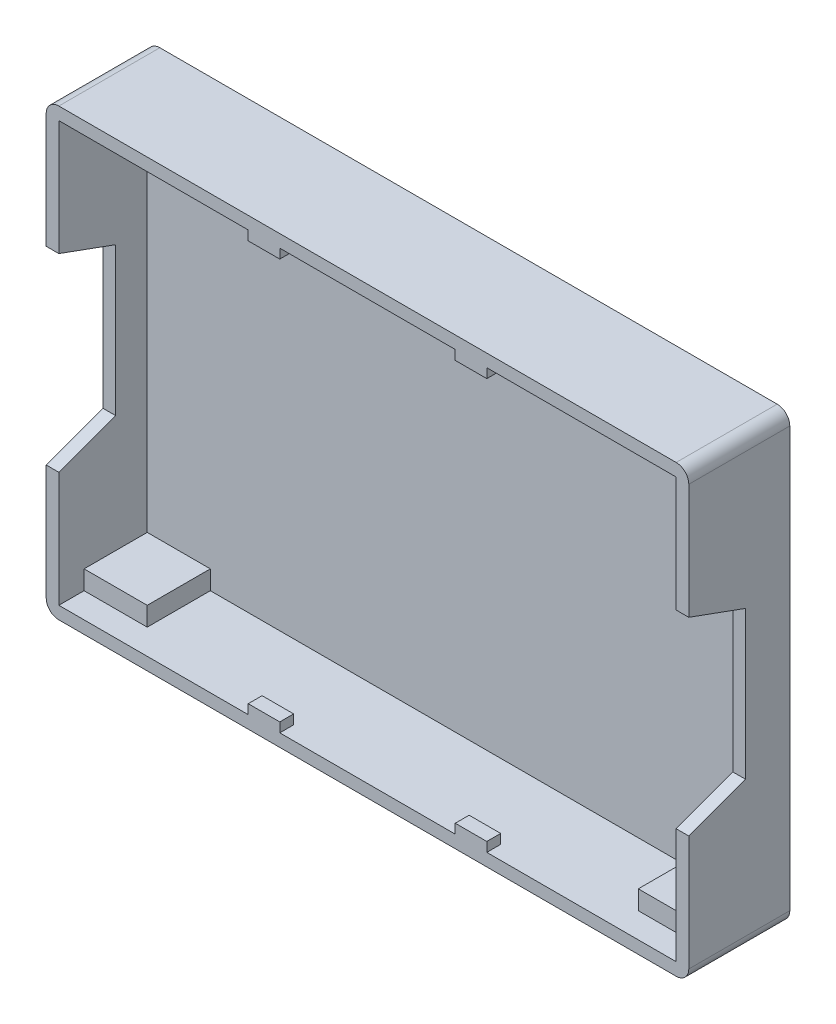
from build123d import *

# Parameters (mm, degrees)
SKETCH1_W                            = 70.5
SKETCH1_H                            = 101.8
SKETCH1_W_2                          = 66.5
SKETCH1_H_2                          = 97.8
BOSS_EXTRUDE1_BOARD_4MM_DEPTH        = 4
SKETCH2_W                            = 101.8
SKETCH2_H                            = 70.5
BOSS_EXTRUDE2_UNDER_10MS_DEPTH       = 10
SKETCH3_W                            = 101.8
SKETCH3_H                            = 70.5
BOSS_EXTRUDE3_BOTTOM_COVER_2MM_DEPTH = 2
SKETCH4_W                            = 5
SKETCH4_H                            = 3.5
BOSS_EXTRUDE4_DEPTH                  = 2.2
SKETCH5_W                            = 128.386338002
SKETCH5_H                            = 30
CUT_EXTRUDE1_CUT_USB_DEPTH           = 9
CUT_EXTRUDE1_CUT_USB_DRAFT           = -20
FILLET1_R                            = 2


with BuildPart() as part:
    # Sketch1 → Boss-Extrude1-board-4mm (new body)
    with BuildSketch(Plane(origin=(0, 0, 0), x_dir=(0, 1, 0), z_dir=(0, 0, 1))):
        Rectangle(SKETCH1_W, SKETCH1_H)
        Rectangle(SKETCH1_W_2, SKETCH1_H_2, mode=Mode.SUBTRACT)
    extrude(amount=BOSS_EXTRUDE1_BOARD_4MM_DEPTH)

    # Sketch2 → Boss-Extrude2-under-10ms (add)
    with BuildSketch(Plane(origin=(0, 0, 0), x_dir=(1, 0, 0), z_dir=(0, 0, -1))):
        Rectangle(SKETCH2_W, SKETCH2_H)
        Polygon((-48.9, 30.25), (-38.9, 30.25), (-38.9, 33.25), (38.9, 33.25), (38.9, 30.25), (48.9, 30.25), (48.9, -30.25), (38.9, -30.25), (38.9, -33.25), (-38.9, -33.25), (-38.9, -30.25), (-48.9, -30.25), align=None, mode=Mode.SUBTRACT)
    extrude(amount=BOSS_EXTRUDE2_UNDER_10MS_DEPTH)

    # Sketch3 → Boss-Extrude3-bottom-cover-2mm (add)
    with BuildSketch(Plane(origin=(0, 0, -10), x_dir=(1, 0, 0), z_dir=(0, 0, -1))):
        Rectangle(SKETCH3_W, SKETCH3_H)
    extrude(amount=BOSS_EXTRUDE3_BOTTOM_COVER_2MM_DEPTH)

    # Sketch4 → Boss-Extrude4 (add)
    with BuildSketch(Plane.XY.offset(1.8)):
        with Locations((-16.4, 33.5)):
            Rectangle(SKETCH4_W, SKETCH4_H)
        with Locations((-16.4, -33.5)):
            Rectangle(SKETCH4_W, SKETCH4_H)
        with Locations((16.4, -33.5)):
            Rectangle(SKETCH4_W, SKETCH4_H)
        with Locations((16.4, 33.5)):
            Rectangle(SKETCH4_W, SKETCH4_H)
    extrude(amount=BOSS_EXTRUDE4_DEPTH)


with BuildPart() as cut_extrude1_cut_usb_tool:
    # Sketch5 → Cut-Extrude1-cut-usb (with draft: the straight prism first)
    with BuildSketch(Plane.XY.offset(4)):
        Rectangle(SKETCH5_W, SKETCH5_H)
    extrude(amount=-CUT_EXTRUDE1_CUT_USB_DEPTH)
    # Cut-Extrude1-cut-usb: the draft: its side faces are tilted about the plane it starts from
    cut_extrude1_cut_usb_sides = [cut_extrude1_cut_usb_tool.faces().sort_by_distance(p)[0] for p in [
        (0, -15, -0.5),
        (64.193169001, 0, -0.5),
        (0, 15, -0.5),
        (-64.193169001, 0, -0.5),
    ]]
    draft(cut_extrude1_cut_usb_sides, Plane.XY.offset(4), CUT_EXTRUDE1_CUT_USB_DRAFT)


with BuildPart() as part_1:
    add(part.part)

    # Cut-Extrude1-cut-usb: cut by cut_extrude1_cut_usb_tool
    add(cut_extrude1_cut_usb_tool.part, mode=Mode.SUBTRACT)

    # Fillet1
    fillet1_edges = [part_1.edges().sort_by_distance(p)[0] for p in [
        (50.9, -35.25, -4),
        (-50.9, -35.25, -4),
        (-50.9, 35.25, -4),
        (50.9, 35.25, -4),
    ]]
    fillet(fillet1_edges, radius=FILLET1_R)


solid = part_1.part
